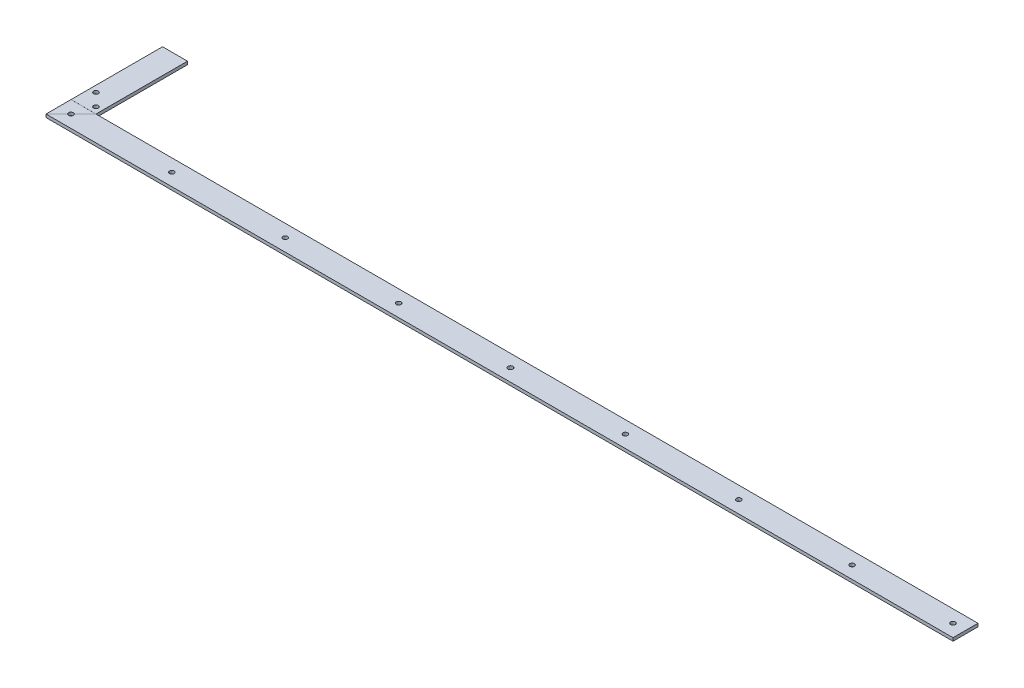
from build123d import *

# Parameters (mm, degrees)
CROQUIS2_W               = 50.8
CROQUIS2_H               = 6.31
CROQUIS3_W               = 50.8
CROQUIS3_H               = 6.31
CROQUIS4_W               = 60
CROQUIS4_H               = 53.155
SALIENTE_EXTRUIR1_DEPTH  = 6.31
CROQUIS5_W               = 60
CROQUIS5_H               = 6.31
CORTAR_EXTRUIR1_DEPTH    = 6.31
CORTAR_EXTRUIR2_DEPTH    = 502
CROQUIS8_W               = 50.8
CROQUIS8_H               = 564.085
CORTAR_EXTRUIR3_DEPTH    = 502
CROQUIS9_W               = 314.3
CROQUIS9_H               = 1090.402933
CORTAR_EXTRUIR4_DEPTH    = 502
CROQUIS10_W              = 50.8
CROQUIS10_H              = 6.31
CORTAR_EXTRUIR5_DEPTH    = 95
CORTAR_EXTRUIR6_DEPTH    = 95
CROQUIS13_W              = 120
CROQUIS13_H              = 249.755
CORTAR_EXTRUIR7_DEPTH    = 95
CROQUIS16_W              = 125
CROQUIS16_H              = 50.8
SALIENTE_EXTRUIR4_DEPTH  = 6.31
CROQUIS17_W              = 50.8
CROQUIS17_H              = 6.31
SALIENTE_EXTRUIR5_DEPTH  = 50.8
SALIENTE_EXTRUIR6_DEPTH  = 50.8
CROQUIS21_W              = 10
CROQUIS21_H              = 50.8
CORTAR_EXTRUIR9_DEPTH    = 53
CROQUIS22_W              = 0.1
CROQUIS22_H              = 50.8
CORTAR_EXTRUIR10_DEPTH   = 10
CORTAR_EXTRUIR11_DEPTH   = 237
CROQUIS24_W              = 50.8
CROQUIS24_H              = 204.986160176
CORTAR_EXTRUIR12_DEPTH   = 237
CROQUIS25_W              = 50.8
CROQUIS25_H              = 6.31
SALIENTE_EXTRUIR7_DEPTH  = 1.1
CROQUIS26_W              = 50.8
CROQUIS26_H              = 6.31
SALIENTE_EXTRUIR8_DEPTH  = 12.7
CROQUIS27_R              = 5
CORTAR_EXTRUIR13_DEPTH   = 10
CROQUIS28_W              = 0.1
CROQUIS28_H              = 50.8
SALIENTE_EXTRUIR9_DEPTH  = 6.31
CROQUIS29_W              = 50.8
CROQUIS29_H              = 0.1
CORTAR_EXTRUIR14_DEPTH   = 50
CROQUIS30_W              = 50.8
CROQUIS30_H              = 6.31
SALIENTE_EXTRUIR10_DEPTH = 50.8
CROQUIS31_R              = 4.7625
CORTAR_EXTRUIR15_DEPTH   = 10
CROQUIS32_R              = 4.7625
CORTAR_EXTRUIR16_DEPTH   = 33
CROQUIS33_R              = 4.7625
CORTAR_EXTRUIR17_DEPTH   = 50
CROQUIS34_R              = 4.7625
CORTAR_EXTRUIR18_DEPTH   = 82


with BuildPart() as part:
    # Barrer1: sweep along a curve in space
    with BuildLine() as barrer1_path:
        Line((0, 0, 0), (0, -567.24, 0))
        Line((0, -567.24, 0), (0, -567.24, 316.2))
        Line((0, -567.24, 316.2), (1786.7, -567.24, 316.2))
        Line((1786.7, -567.24, 316.2), (1786.7, -567.24, 578))
        Line((1786.7, -567.24, 578), (1786.7, -435.47278313, 578))
        Line((1786.7, -435.47278313, 578), (1786.7, -435.47278313, 1432.002933))
    # Croquis2 → Barrer1 (sweep)
    with BuildSketch(Plane(origin=(0, 0, 0), x_dir=(1, 0, 0), z_dir=(0, 1, 0))):
        Rectangle(CROQUIS2_W, CROQUIS2_H)
        with Locations((263.5, 0)):
            Rectangle(CROQUIS2_W, CROQUIS2_H)
    sweep(path=barrer1_path.line, transition=Transition.RIGHT)

    # Barrer4: sweep along a curve in space
    with BuildLine() as barrer4_path:
        Line((-0.201028049, -3.155, -3.155), (-0.201028049, -3.155, -207.155))
        Line((-0.201028049, -3.155, -207.155), (-0.201028049, -53.155, -207.155))
    # Croquis3 → Barrer4 (sweep)
    with BuildSketch(Plane(origin=(0, 0, -3.155), x_dir=(-1, 0, 0), z_dir=(0, 0, -1))):
        with Locations((-263.5, -3.155)):
            Rectangle(CROQUIS3_W, CROQUIS3_H)
        with Locations((0, -3.155)):
            Rectangle(CROQUIS3_W, CROQUIS3_H)
    sweep(path=barrer4_path.line, transition=Transition.RIGHT)

    # Croquis4 → Saliente-Extruir1 (add)
    with BuildSketch(Plane(origin=(0, 0, -210.31), x_dir=(-1, 0, 0), z_dir=(0, 0, -1))):
        with Locations((-208.1, -26.5775)):
            Rectangle(CROQUIS4_W, CROQUIS4_H)
    extrude(amount=-SALIENTE_EXTRUIR1_DEPTH)

    # Croquis5 → Cortar-Extruir1 (cut)
    with BuildSketch(Plane.XY.offset(-204)):
        with Locations((208.1, -3.155)):
            Rectangle(CROQUIS5_W, CROQUIS5_H)
    extrude(amount=-CORTAR_EXTRUIR1_DEPTH, mode=Mode.SUBTRACT)

    # Croquis7 → Cortar-Extruir2 (cut)
    with BuildSketch(Plane.XY.offset(3.155)):
        Polygon((288.9, -564.085), (238.1, -564.085), (238.1, -68.875540851), (170.611072112, -68.875540851), (170.611072112, 0), (288.9, 0), align=None)
    extrude(amount=-CORTAR_EXTRUIR2_DEPTH, mode=Mode.SUBTRACT)

    # Croquis8 → Cortar-Extruir3 (cut)
    with BuildSketch(Plane.XY.offset(3.155)):
        with Locations((0, -282.0425)):
            Rectangle(CROQUIS8_W, CROQUIS8_H)
    extrude(amount=-CORTAR_EXTRUIR3_DEPTH, mode=Mode.SUBTRACT)

    # Croquis9 → Cortar-Extruir4 (cut)
    with BuildSketch(Plane(origin=(0, -432.31778313, 0), x_dir=(1, 0, 0), z_dir=(0, 1, 0))):
        with Locations((1918.45, -886.8014665)):
            Rectangle(CROQUIS9_W, CROQUIS9_H)
    extrude(amount=-CORTAR_EXTRUIR4_DEPTH, mode=Mode.SUBTRACT)

    # Croquis10 → Cortar-Extruir5 (cut)
    with BuildSketch(Plane(origin=(0, 0, -3.155), x_dir=(-1, 0, 0), z_dir=(0, 0, -1))):
        with Locations((0, -567.24)):
            Rectangle(CROQUIS10_W, CROQUIS10_H)
    extrude(amount=-CORTAR_EXTRUIR5_DEPTH, mode=Mode.SUBTRACT)

    # Croquis11 → Cortar-Extruir6 (cut)
    with BuildSketch(Plane(origin=(0, -564.085, 0), x_dir=(1, 0, 0), z_dir=(0, 1, 0))):
        Polygon((238.1, -78.1), (288.9, -78.1), (288.9, -27.3), align=None)
        Polygon((238.1, -78.1), (288.9, -27.3), (238.1, -27.3), align=None)
        Polygon((238.1, -27.3), (288.9, -27.3), (288.9, -3.155), (288.9, 3.155), (238.1, 3.155), (238.1, -3.155), align=None)
    extrude(amount=-CORTAR_EXTRUIR6_DEPTH, mode=Mode.SUBTRACT)

    # Croquis13 → Cortar-Extruir7 (cut)
    with BuildSketch(Plane(origin=(0, -564.085, 0), x_dir=(1, 0, 0), z_dir=(0, 1, 0))):
        with Locations((34.6, -216.7225)):
            Rectangle(CROQUIS13_W, CROQUIS13_H)
    extrude(amount=-CORTAR_EXTRUIR7_DEPTH, mode=Mode.SUBTRACT)

    # Croquis16 → Saliente-Extruir4 (add)
    with BuildSketch(Plane(origin=(0, -564.085, 0), x_dir=(1, 0, 0), z_dir=(0, 1, 0))):
        with Locations((226.4, -52.7)):
            Rectangle(CROQUIS16_W, CROQUIS16_H)
    extrude(amount=-SALIENTE_EXTRUIR4_DEPTH)

    # Barrer5: sweep along a curve in space
    with BuildLine() as barrer5_path:
        Line((94.6, -567.24, 316.2), (46.55, -567.24, 316.2))
        Line((46.55, -567.24, 316.2), (46.55, -567.24, 105.72))
    # Croquis17 → Barrer5 (sweep)
    with BuildSketch(Plane.ZY.offset(-94.6)):
        with Locations((316.2, -567.24)):
            Rectangle(CROQUIS17_W, CROQUIS17_H)
    sweep(path=barrer5_path.line, transition=Transition.RIGHT)

    # Croquis20 → Saliente-Extruir6 (add)
    with BuildSketch(Plane.ZY.offset(-163.9)):
        Polygon((78.1, -564.085), (78.1, -439.884522326), (59.966060883, -387.925515276), (54.008468178, -390.004743297), (71.79, -440.954001003), (71.79, -564.085), align=None)
    extrude(amount=-SALIENTE_EXTRUIR6_DEPTH)

    # Croquis21 → Cortar-Extruir9 (cut)
    with BuildSketch(Plane(origin=(0, -564.085, 0), x_dir=(1, 0, 0), z_dir=(0, 1, 0))):
        with Locations((1807.1, -316.2)):
            Rectangle(CROQUIS21_W, CROQUIS21_H)
    extrude(amount=-CORTAR_EXTRUIR9_DEPTH, mode=Mode.SUBTRACT)

    # Croquis22 → Cortar-Extruir10 (cut)
    with BuildSketch(Plane(origin=(0, -564.085, 0), x_dir=(1, 0, 0), z_dir=(0, 1, 0))):
        with Locations((72, -316.2)):
            Rectangle(CROQUIS22_W, CROQUIS22_H)
    extrude(amount=-CORTAR_EXTRUIR10_DEPTH, mode=Mode.SUBTRACT)

    # Croquis23 → Cortar-Extruir11 (cut)
    with BuildSketch(Plane.XZ.offset(570.395)):
        Polygon((2024.8, 341.6), (2024.8, 78.1), (163.9, 78.1), (163.9, 0), (2111.300371304, 0), (2111.300371304, 341.6), align=None)
    extrude(amount=-CORTAR_EXTRUIR11_DEPTH, mode=Mode.SUBTRACT)

    # Croquis25 → Saliente-Extruir7 (add)
    with BuildSketch(Plane(origin=(0, 0, 105.72), x_dir=(-1, 0, 0), z_dir=(0, 0, -1))):
        with Locations((-46.55, -567.24)):
            Rectangle(CROQUIS25_W, CROQUIS25_H)
    extrude(amount=SALIENTE_EXTRUIR7_DEPTH)

    # Croquis26 → Saliente-Extruir8 (add)
    with BuildSketch(Plane(origin=(1802.1, 0, 0), x_dir=(0, 0, -1), z_dir=(1, 0, 0))):
        with Locations((-316.2, -567.24)):
            Rectangle(CROQUIS26_W, CROQUIS26_H)
    extrude(amount=SALIENTE_EXTRUIR8_DEPTH)

    # Croquis27 → Cortar-Extruir13 (cut)
    with BuildSketch(Plane(origin=(0, -564.085, 0), x_dir=(1, 0, 0), z_dir=(0, 1, 0))):
        with Locations(Location((940.200000079, -316.2, 0), (0, 0, 270))):
            Circle(CROQUIS27_R)
    extrude(amount=-CORTAR_EXTRUIR13_DEPTH, mode=Mode.SUBTRACT)

    # Croquis28 → Saliente-Extruir9 (add)
    with BuildSketch(Plane(origin=(0, -564.085, 0), x_dir=(1, 0, 0), z_dir=(0, 1, 0))):
        with Locations((72, -316.2)):
            Rectangle(CROQUIS28_W, CROQUIS28_H)
    extrude(amount=-SALIENTE_EXTRUIR9_DEPTH)

    # Croquis29 → Cortar-Extruir14 (cut)
    with BuildSketch(Plane(origin=(0, -564.085, 0), x_dir=(1, 0, 0), z_dir=(0, 1, 0))):
        with Locations((46.55, -290.75)):
            Rectangle(CROQUIS29_W, CROQUIS29_H)
    extrude(amount=-CORTAR_EXTRUIR14_DEPTH, mode=Mode.SUBTRACT)


with BuildPart() as body_2:
    # Croquis18 → Saliente-Extruir5 (new body)
    with BuildSketch(Plane.ZY.offset(-21.15)):
        Polygon((98.787204793, -564.085), (98.787204793, -435.522965931), (64.969988324, -367.622744457), (59.321737777, -370.435814978), (91.897545374, -435.843461779), (91.842933, -564.085), align=None)
    extrude(amount=-SALIENTE_EXTRUIR5_DEPTH)

    # Croquis24 → Cortar-Extruir12 (cut)
    with BuildSketch(Plane.XY.offset(98.787204793)):
        with Locations((46.55, -461.591919912)):
            Rectangle(CROQUIS24_W, CROQUIS24_H)
    extrude(amount=-CORTAR_EXTRUIR12_DEPTH, mode=Mode.SUBTRACT)


with BuildPart() as cortar_extruir14_piece_1:
    # of the separate pieces the step leaves, piece 1, a body of its own (cortar_extruir14_pieces)
    add(part.part.solids().sort_by_distance((1814.8, -570.395, 341.6))[0])

    # Croquis30 → Saliente-Extruir10 (add)
    with BuildSketch(Plane(origin=(1814.8, 0, 0), x_dir=(0, 0, -1), z_dir=(1, 0, 0))):
        with Locations((-316.2, -567.24)):
            Rectangle(CROQUIS30_W, CROQUIS30_H)
    extrude(amount=SALIENTE_EXTRUIR10_DEPTH)

    # Croquis31 → Cortar-Extruir15 (cut)
    with BuildSketch(Plane(origin=(0, -564.085, 0), x_dir=(1, 0, 0), z_dir=(0, 1, 0))):
        with Locations(Location((1840.2, -316.2, 0), (0, 0, 270))):
            Circle(CROQUIS31_R)
    extrude(amount=-CORTAR_EXTRUIR15_DEPTH, mode=Mode.SUBTRACT)

    # Croquis32 → Cortar-Extruir16 (cut)
    with BuildSketch(Plane(origin=(0, -564.085, 0), x_dir=(1, 0, 0), z_dir=(0, 1, 0))):
        with Locations(Location((46.55, -316.2, 0), (0, 0, 225))):
            Circle(CROQUIS32_R)
    extrude(amount=-CORTAR_EXTRUIR16_DEPTH, mode=Mode.SUBTRACT)

    # Croquis34 → Cortar-Extruir18 (cut)
    with BuildSketch(Plane(origin=(0, -564.085, 0), x_dir=(1, 0, 0), z_dir=(0, 1, 0))):
        with Locations(Location((1635.04375, -316.2, 0), (0, 0, 270))):
            Circle(CROQUIS34_R)
        with Locations(Location((1404.4875, -316.2, 0), (0, 0, 270))):
            Circle(CROQUIS34_R)
        with Locations(Location((1173.93125, -316.2, 0), (0, 0, 270))):
            Circle(CROQUIS34_R)
        with Locations(Location((712.81875, -316.2, 0), (0, 0, 270))):
            Circle(CROQUIS34_R)
        with Locations(Location((482.2625, -316.2, 0), (0, 0, 270))):
            Circle(CROQUIS34_R)
        with Locations(Location((251.70625, -316.2, 0), (0, 0, 270))):
            Circle(CROQUIS34_R)
    extrude(amount=-CORTAR_EXTRUIR18_DEPTH, mode=Mode.SUBTRACT)


with BuildPart() as cortar_extruir14_piece_2:
    # of the separate pieces the step leaves, piece 2, a body of its own (cortar_extruir14_pieces)
    add(part.part.solids().sort_by_distance((21.15, -570.395, 290.7))[0])

    # Croquis33 → Cortar-Extruir17 (cut)
    with BuildSketch(Plane(origin=(0, -570.395, 0), x_dir=(-1, 0, 0), z_dir=(0, -1, 0))):
        with Locations(Location((-33.85, -252.7, 0), (0, 0, 90))):
            Circle(CROQUIS33_R)
        with Locations(Location((-59.25, -278.1, 0), (0, 0, 90))):
            Circle(CROQUIS33_R)
    extrude(amount=-CORTAR_EXTRUIR17_DEPTH, mode=Mode.SUBTRACT)


solid = Compound([cortar_extruir14_piece_1.part, cortar_extruir14_piece_2.part])
